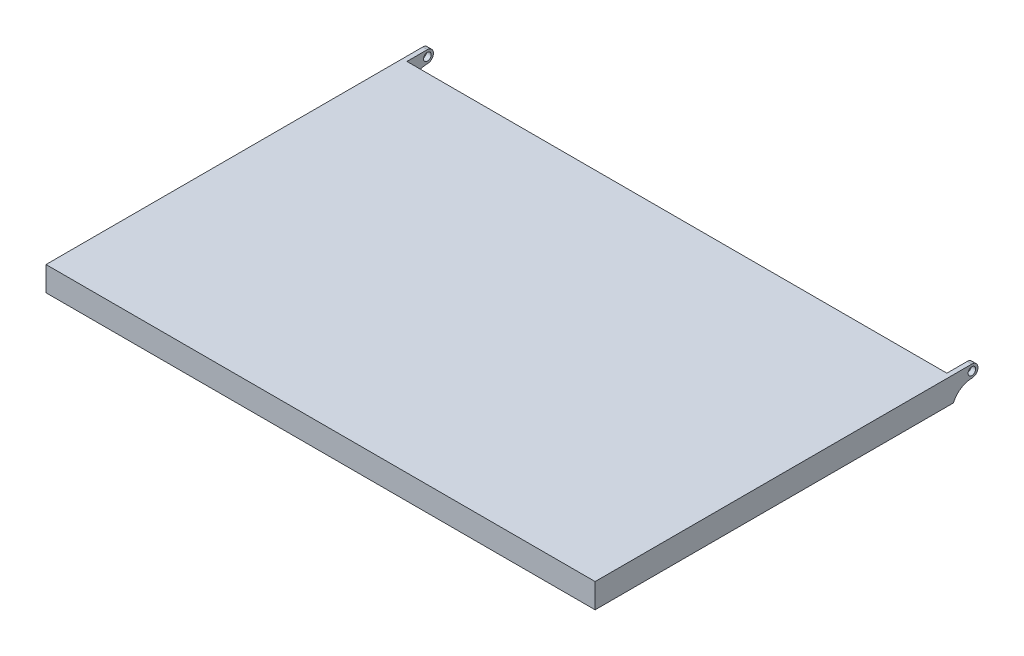
from build123d import *

# Parameters (mm, degrees)
CROQUIS1_W              = 569.383333334
CROQUIS1_H              = 369.485333334
SALIENTE_EXTRUIR1_DEPTH = 25.4
VACIADO1_T              = -3.175
CROQUIS2_R              = 3.96875
SALIENTE_EXTRUIR2_DEPTH = 4.7625


with BuildPart() as part:
    # Croquis1 → Saliente-Extruir1 (new body)
    with BuildSketch(Plane(origin=(0, 0, 0), x_dir=(1, 0, 0), z_dir=(0, 1, 0))):
        with Locations((327.025, 227.076)):
            Rectangle(CROQUIS1_W, CROQUIS1_H)
    extrude(amount=SALIENTE_EXTRUIR1_DEPTH)

    # Vaciado1
    vaciado1_openings = [part.faces().sort_by_distance(p)[0] for p in [
        (327.025, 0, -227.076),
    ]]
    offset(amount=VACIADO1_T, openings=vaciado1_openings, kind=Kind.INTERSECTION)

    # Croquis2 → Saliente-Extruir2 (add)
    with BuildSketch(Plane(origin=(611.716666667, 0, 0), x_dir=(0, 0, -1), z_dir=(1, 0, 0))):
        with BuildLine():
            Line((411.818666667, 0), (411.818666667, 25.4))
            Line((411.818666667, 25.4), (432.983666667, 25.4))
            ThreePointArc((432.983666667, 25.4), (439.333666667, 19.05), (432.983666667, 12.7))
            ThreePointArc((432.983666667, 12.7), (421.536041367, 9.233937949), (413.933666667, 0))
            Line((413.933666667, 0), (411.818666667, 0))
        make_face()
        with Locations((432.983666667, 19.05)):
            Circle(CROQUIS2_R, mode=Mode.SUBTRACT)
    saliente_extruir2 = extrude(amount=-SALIENTE_EXTRUIR2_DEPTH)

    # Simetría1: Saliente-Extruir2 across plane
    add(saliente_extruir2.mirror(Plane(origin=(327.025, 0, 0), x_dir=(0, 0, 1), z_dir=(1, 0, 0))))


solid = part.part
